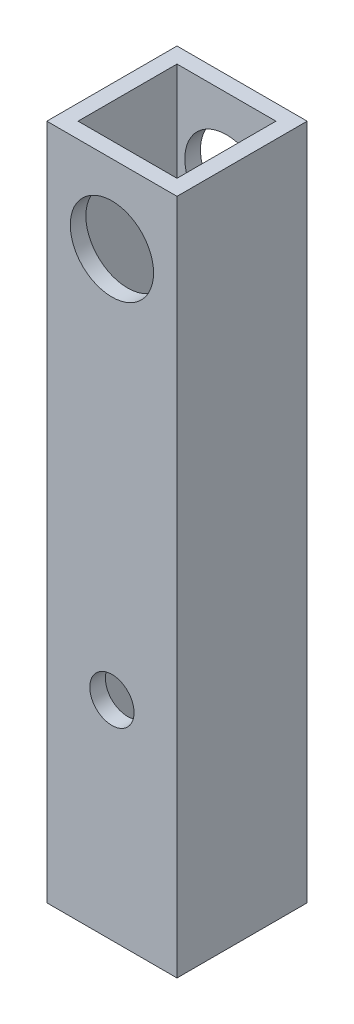
from build123d import *

# Parameters (mm, degrees)
SKETCH1_W           = 25
SKETCH1_H           = 25
SKETCH1_W_2         = 19
SKETCH1_H_2         = 19
BOSS_EXTRUDE1_DEPTH = 130
SKETCH2_R           = 4.25
SKETCH2_R_2         = 8
CUT_EXTRUDE1_DEPTH  = 135.721935853


with BuildPart() as part:
    # Sketch1 → Boss-Extrude1 (new body)
    with BuildSketch(Plane(origin=(0, 0, 0), x_dir=(1, 0, 0), z_dir=(0, 1, 0))):
        with Locations((12.5, 12.5)):
            Rectangle(SKETCH1_W, SKETCH1_H)
        with Locations((12.5, 12.5)):
            Rectangle(SKETCH1_W_2, SKETCH1_H_2, mode=Mode.SUBTRACT)
    extrude(amount=BOSS_EXTRUDE1_DEPTH)

    # Sketch2 → Cut-Extrude1 (cut, through all)
    with BuildSketch(Plane.XY):
        with Locations((12.5, 40)):
            Circle(SKETCH2_R)
        with Locations((12.5, 115)):
            Circle(SKETCH2_R_2)
    extrude(amount=-CUT_EXTRUDE1_DEPTH, mode=Mode.SUBTRACT)


solid = part.part
